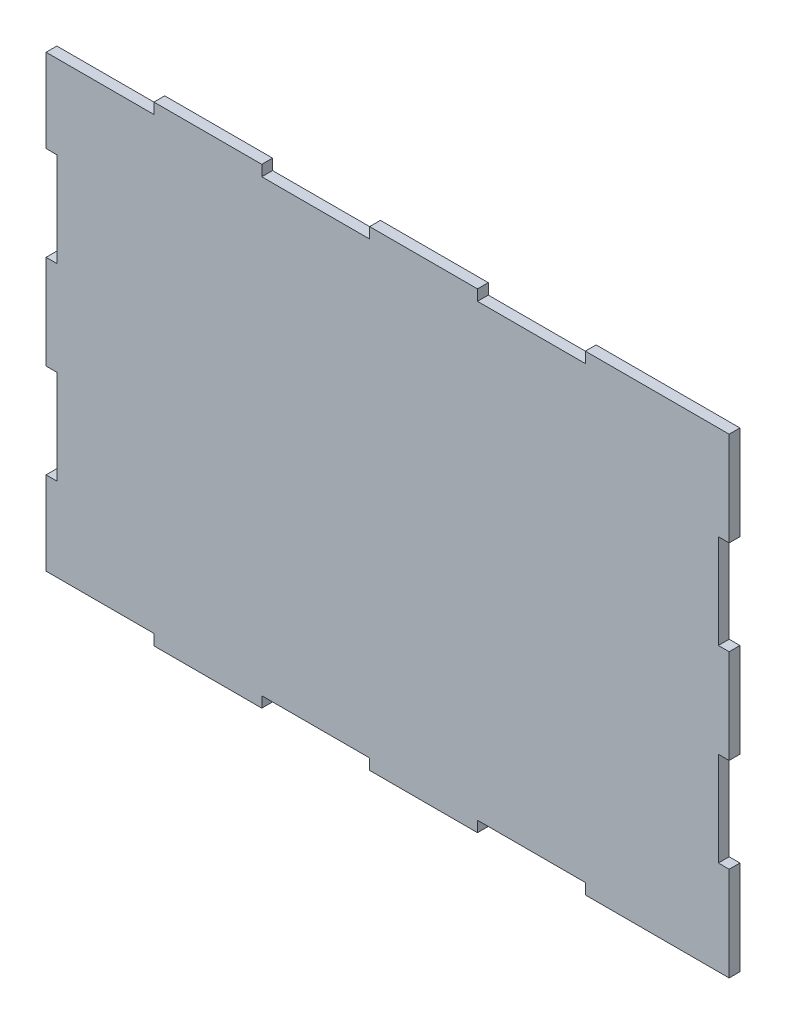
from build123d import *

# Parameters (mm, degrees)
BOSS_EXTRUDE1_DEPTH = 3


with BuildPart() as part:
    # Sketch1 → Boss-Extrude1 (new body)
    with BuildSketch(Plane.XY):
        Polygon((60, 128), (60, 131), (30, 131), (30, 128), (0, 128), (0, 104.8), (3, 104.8), (3, 78.6), (0, 78.6), (0, 52.4), (3, 52.4), (3, 26.2), (0, 26.2), (0, 3), (30, 3), (30, 0), (60, 0), (60, 3), (90, 3), (90, 0), (120, 0), (120, 3), (150, 3), (150, 0), (190, 0), (190, 26.2), (187, 26.2), (187, 52.4), (190, 52.4), (190, 78.6), (187, 78.6), (187, 104.8), (190, 104.8), (190, 131), (150, 131), (150, 128), (120, 128), (120, 131), (90, 131), (90, 128), align=None)
    extrude(amount=BOSS_EXTRUDE1_DEPTH)


solid = part.part
